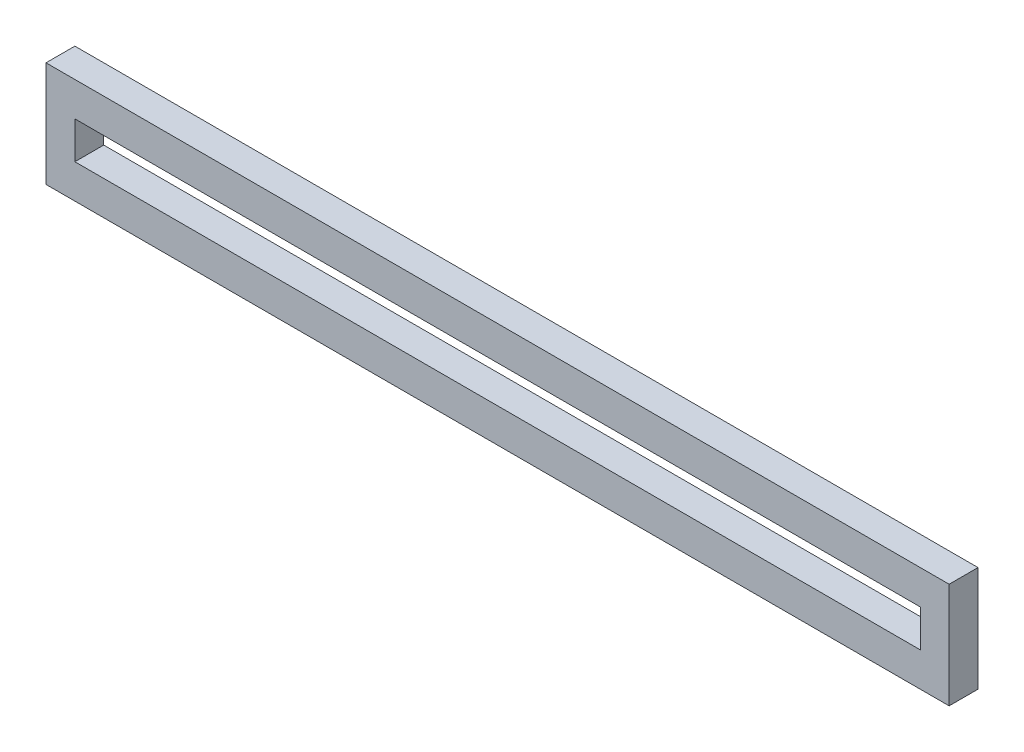
from build123d import *

# Parameters (mm, degrees)
SKETCH1_W           = 74.381104322
SKETCH1_H           = 3.27
BOSS_EXTRUDE1_DEPTH = 2.54


with BuildPart() as part:
    # Sketch1 → Boss-Extrude1 (new body)
    with BuildSketch(Plane.XY):
        Polygon((39.730552161, 0), (-39.730552161, 0), (-39.730552161, -6.27), (-39.730552161, -9.27), (39.730552161, -9.27), (39.730552161, -3), align=None)
        with Locations((0, -4.635)):
            Rectangle(SKETCH1_W, SKETCH1_H, mode=Mode.SUBTRACT)
    extrude(amount=BOSS_EXTRUDE1_DEPTH)


solid = part.part
